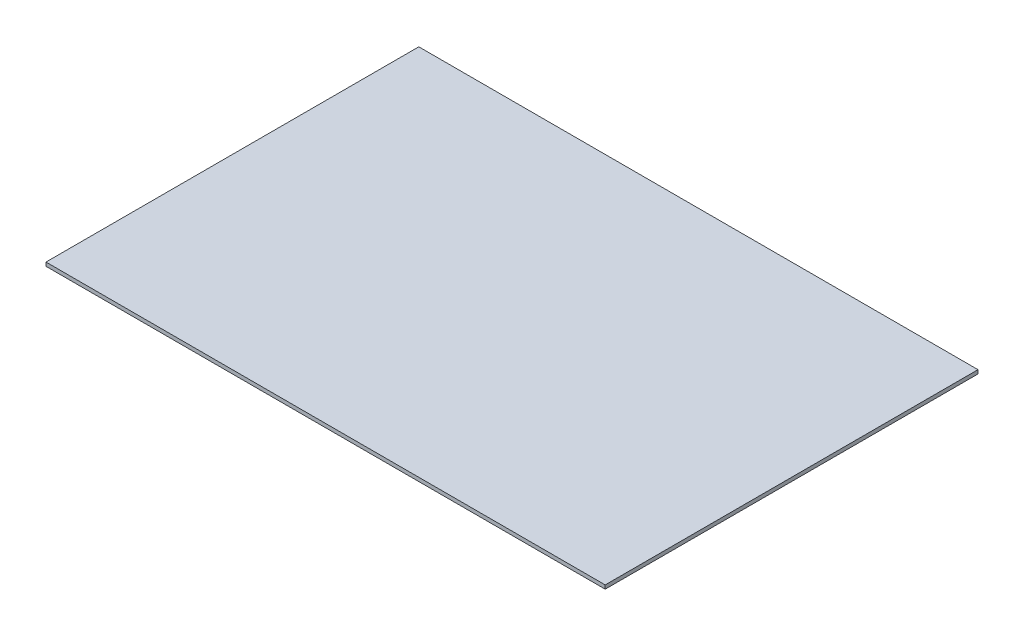
from build123d import *

# Parameters (mm, degrees)
SKETCH1_W           = 300
SKETCH1_H           = 200
BOSS_EXTRUDE1_DEPTH = 2


with BuildPart() as part:
    # Sketch1 → Boss-Extrude1 (new body)
    with BuildSketch(Plane(origin=(0, 0, 0), x_dir=(1, 0, 0), z_dir=(0, 1, 0))):
        Rectangle(SKETCH1_W, SKETCH1_H)
    extrude(amount=BOSS_EXTRUDE1_DEPTH)


solid = part.part
